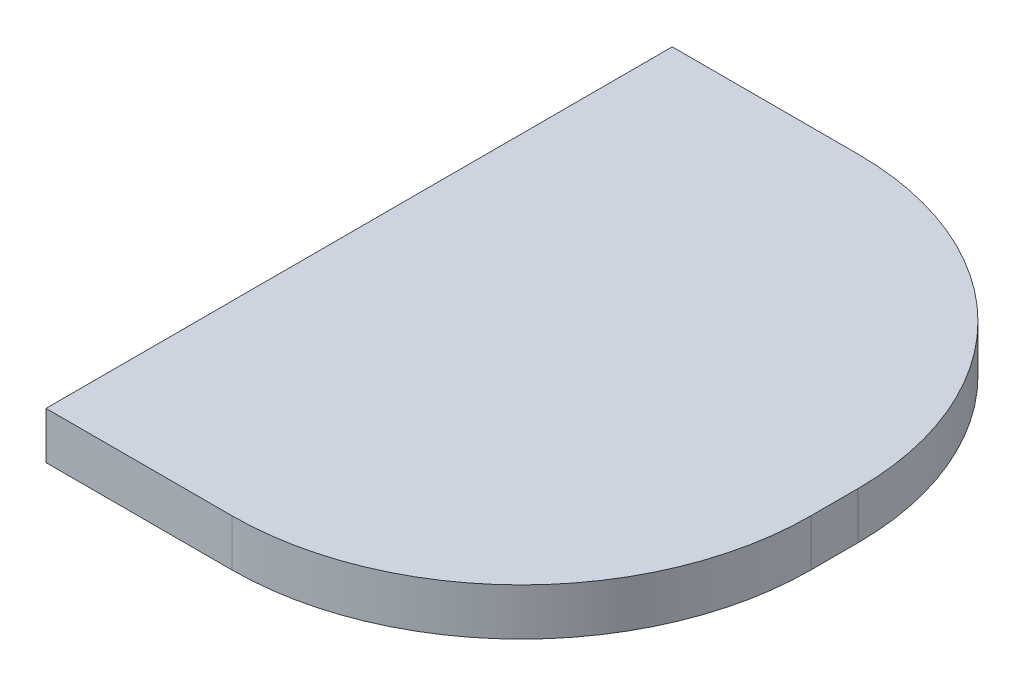
from build123d import *

# Parameters (mm, degrees)
SKETCH1_W           = 30.366608602
SKETCH1_H           = 3
BOSS_EXTRUDE1_DEPTH = 40
FILLET1_R           = 18.5


with BuildPart() as part:
    # Sketch1 → Boss-Extrude1 (new body)
    with BuildSketch(Plane.XY):
        Rectangle(SKETCH1_W, SKETCH1_H)
    extrude(amount=BOSS_EXTRUDE1_DEPTH)

    # Fillet1
    fillet1_edges = [part.edges().sort_by_distance(p)[0] for p in [
        (15.183304301, 0, 40),
        (15.183304301, 0, 0),
    ]]
    fillet(fillet1_edges, radius=FILLET1_R)


solid = part.part
